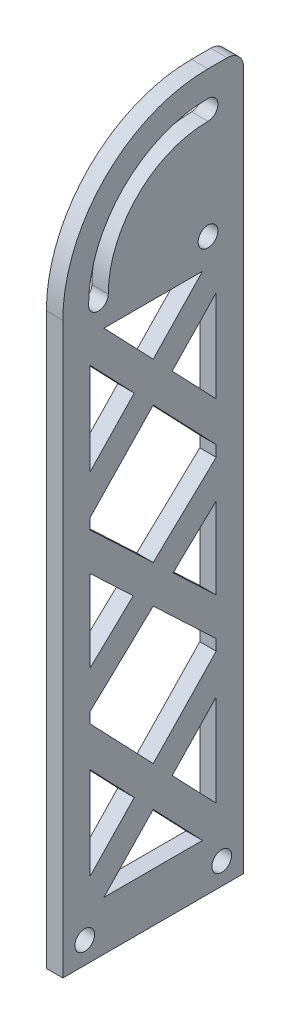
from build123d import *

# Parameters (mm, degrees)
SKETCH1_R            = 1.5
BOSS_EXTRUDE1_DEPTH  = 3
M3_CLEARANCE_HOLE1_D = 3.6
CUT_EXTRUDE1_DEPTH   = 10


with BuildPart() as part:
    # Sketch1 → Boss-Extrude1 (new body)
    with BuildSketch(Plane(origin=(0, 0, 0), x_dir=(0, 0, -1), z_dir=(1, 0, 0))):
        with BuildLine():
            Line((33, 103.968745116), (33, 127.468745116))
            ThreePointArc((33, 127.468745116), (32.121320344, 129.590065459), (30, 130.468745116))
            Line((30, 130.468745116), (26.5, 130.468745116))
            ThreePointArc((26.5, 130.468745116), (7.761670299, 122.707074817), (0, 103.968745116))
            Line((0, 103.968745116), (0, 0))
            Line((0, 0), (33, 0))
            Line((33, 0), (33, 103.968745116))
        make_face()
        with Locations((4, 4)):
            Circle(SKETCH1_R, mode=Mode.SUBTRACT)
        with Locations((29, 4)):
            Circle(SKETCH1_R, mode=Mode.SUBTRACT)
        with Locations((26.5, 103.968745116)):
            Circle(SKETCH1_R, mode=Mode.SUBTRACT)
        with BuildLine():
            ThreePointArc((4.7, 103.968745116), (11.08507217, 119.383672946), (26.5, 125.768745116))
            ThreePointArc((26.5, 125.768745116), (28.3, 123.968745116), (26.5, 122.168745116))
            ThreePointArc((26.5, 122.168745116), (13.630656582, 116.838088533), (8.3, 103.968745116))
            ThreePointArc((8.3, 103.968745116), (6.5, 102.168745116), (4.7, 103.968745116))
        make_face(mode=Mode.SUBTRACT)
    extrude(amount=BOSS_EXTRUDE1_DEPTH)

    # M3 Clearance Hole1 (through all)
    with Locations(Plane.ZY):
        with Locations((-29, 4), (-4, 4), (-26.5, 103.968745116)):
            Hole(M3_CLEARANCE_HOLE1_D / 2)

    # Sketch4 → Cut-Extrude1 (cut)
    with BuildSketch(Plane(origin=(3, 0, 0), x_dir=(0, 0, -1), z_dir=(1, 0, 0))):
        Polygon((5, 13.619501596), (13.039872779, 22.021779252), (5, 30.424056909), align=None)
        Polygon((7.5, 9), (25.5, 9), (16.5, 18.405683521), align=None)
        Polygon((28, 30.424056909), (19.960127221, 22.021779252), (28, 13.619501596), align=None)
        Polygon((5, 37.656248372), (16.5, 25.637874984), (28, 37.656248372), (28, 39.656248372), (16.5, 50.541969576), (5, 39.656248372), align=None)
        Polygon((20.136657006, 53.984372558), (28, 46.541054335), (28, 61.427690781), align=None)
        Polygon((5, 61.427690781), (5, 46.541054335), (12.863342994, 53.984372558), align=None)
        Polygon((5, 70.312496744), (5, 68.312496744), (16.5, 57.426775539), (28, 68.312496744), (28, 70.312496744), (16.5, 82.330870131), align=None)
        Polygon((19.960127221, 85.946965863), (28, 77.544688207), (28, 94.349243519), align=None)
        Polygon((5, 94.349243519), (5, 77.544688207), (13.039872779, 85.946965863), align=None)
        Polygon((7.5, 98.968745116), (16.5, 89.563061595), (25.5, 98.968745116), align=None)
    extrude(amount=-CUT_EXTRUDE1_DEPTH, mode=Mode.SUBTRACT)


solid = part.part
